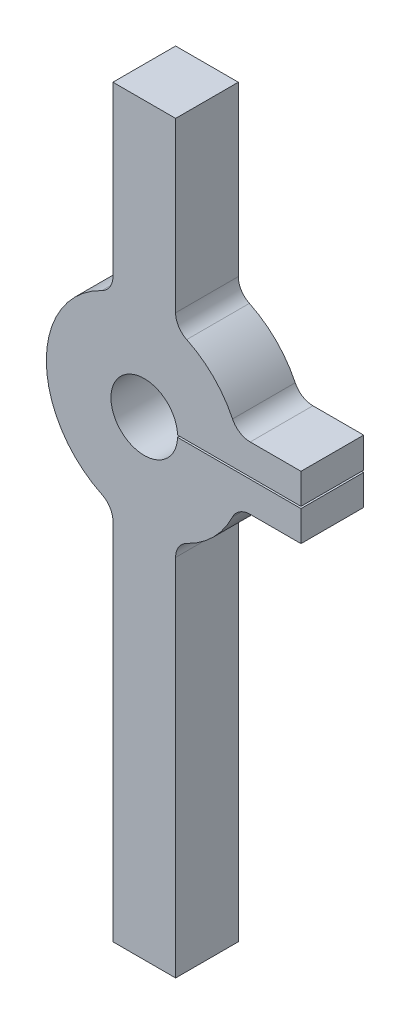
from build123d import *

# Parameters (mm, degrees)
SKETCH1_R               = 25
SKETCH1_R_2             = 8.5
BOSS_EXTRUDE1_DEPTH     = 8
SKETCH2_W               = 16
SKETCH2_H               = 46.314561435
BOSS_EXTRUDE2_DEPTH     = 8
SKETCH3_W               = 16
SKETCH3_H               = 96.314561435
BOSS_EXTRUDE3_DEPTH     = 8
SKETCH4_W               = 16.314561435
SKETCH4_H               = 16
BOSS_EXTRUDE4_DEPTH     = 8
CUT_EXTRUDE1_DEPTH      = 127.743836142
CUT_EXTRUDE1_DEPTH_BACK = 127.743836142
SKETCH5_W               = 48
SKETCH5_H               = 0.5
FILLET1_R               = 5
SKETCH7_W               = 3
SKETCH7_H               = 5.5


with BuildPart() as part:
    # Sketch1 → Boss-Extrude1 (new, symmetric)
    with BuildSketch(Plane.XY):
        Circle(SKETCH1_R)
        Circle(SKETCH1_R_2, mode=Mode.SUBTRACT)
    extrude(amount=BOSS_EXTRUDE1_DEPTH, both=True)

    # Sketch2 → Boss-Extrude2 (add, symmetric)
    with BuildSketch(Plane.XY):
        with Locations((0, 46.842719282)):
            Rectangle(SKETCH2_W, SKETCH2_H)
    extrude(amount=BOSS_EXTRUDE2_DEPTH, both=True)

    # Sketch3 → Boss-Extrude3 (add, symmetric)
    with BuildSketch(Plane.XY):
        with Locations((0, -71.842719283)):
            Rectangle(SKETCH3_W, SKETCH3_H)
    extrude(amount=BOSS_EXTRUDE3_DEPTH, both=True)

    # Sketch4 → Boss-Extrude4 (add, symmetric)
    with BuildSketch(Plane.XY):
        with Locations((31.842719282, 0)):
            Rectangle(SKETCH4_W, SKETCH4_H)
    extrude(amount=BOSS_EXTRUDE4_DEPTH, both=True)

    # Sketch5 → Cut-Extrude1 (cut, two sides: drawn at the far end of the back side and taken through both)
    with BuildSketch(Plane.XY.offset(-CUT_EXTRUDE1_DEPTH_BACK)):
        with Locations((26, 0)):
            Rectangle(SKETCH5_W, SKETCH5_H)
    extrude(amount=CUT_EXTRUDE1_DEPTH + CUT_EXTRUDE1_DEPTH_BACK, mode=Mode.SUBTRACT)

    # Fillet1
    fillet1_edges = [part.edges().sort_by_distance(p)[0] for p in [
        (8, 23.685438565, 0),
        (-8, 23.685438565, 0),
        (8, -23.685438565, 0),
        (-8, -23.685438565, 0),
        (23.685438565, -8, 0),
        (23.685438565, 8, 0),
    ]]
    fillet(fillet1_edges, radius=FILLET1_R)

    # Sketch7 → Cut-Revolve1 (revolve, cut)
    with BuildSketch(Plane(origin=(0, 0, 0), x_dir=(0, 0, -1), z_dir=(1, 0, 0))):
        with Locations((6.5, 11.25)):
            Rectangle(SKETCH7_W, SKETCH7_H)
    revolve(axis=Axis((0, 0, 0), (0, 0, -1)), mode=Mode.SUBTRACT)


solid = part.part
